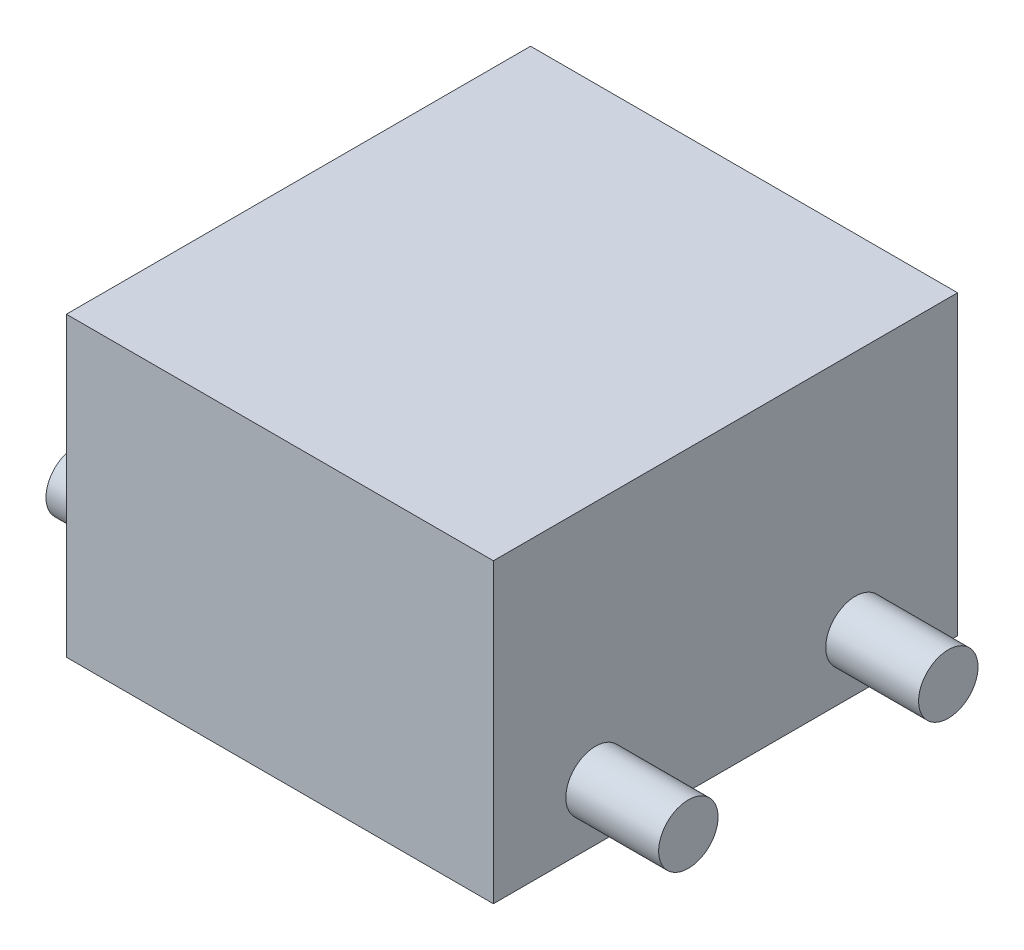
from build123d import *

# Parameters (mm, degrees)
EXTRUDE_2_DEPTH = 80
SKETCH_1_R      = 8
EXTRUDE_3_DEPTH = 82.5


with BuildPart() as part:
    # Sketch 3D_1 → 보스-돌출2 (new body)
    with BuildSketch(Plane(origin=(-57.5, 0, 62.5), x_dir=(0.6770565308208834, 0, -0.7359310117618296), z_dir=(0, -1, 0))):
        Polygon((0, 0), (77.861501044, 84.632066353), (169.852877515, 0), (91.99137647, -84.632066353), align=None)
    extrude(amount=-EXTRUDE_2_DEPTH)

    # 스케치1 → 보스-돌출3 (add, symmetric)
    with BuildSketch(Plane(origin=(0, 0, 0), x_dir=(0, 0, -1), z_dir=(1, 0, 0))):
        with Locations((-35, 15)):
            Circle(SKETCH_1_R)
    extrude_3 = extrude(amount=EXTRUDE_3_DEPTH, both=True)

    # 대칭 복사1: 보스-돌출3 across plane
    add(extrude_3.mirror(Plane.XY))


solid = part.part
